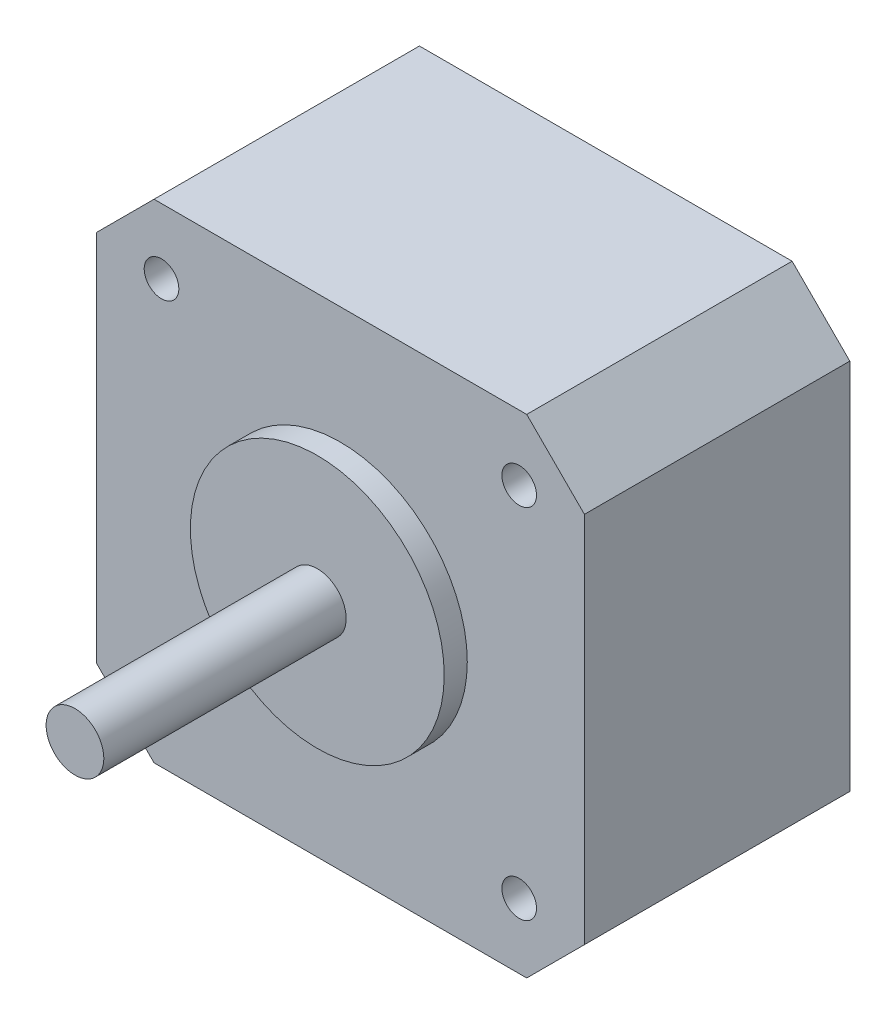
from build123d import *

# Parameters (mm, degrees)
SKETCH1_W           = 42.3
SKETCH1_H           = 42.3
BOSS_EXTRUDE1_DEPTH = 23
CHAMFER1_SIZE       = 5
SKETCH3_R           = 1.5
CUT_EXTRUDE1_DEPTH  = 5
SKETCH4_R           = 11
BOSS_EXTRUDE2_DEPTH = 2
SKETCH5_R           = 2.5
BOSS_EXTRUDE3_DEPTH = 23
SKETCH6_W           = 16
SKETCH6_H           = 7
BOSS_EXTRUDE4_DEPTH = 9.6


with BuildPart() as part:
    # Sketch1 → Boss-Extrude1 (new body)
    with BuildSketch(Plane.XY):
        Rectangle(SKETCH1_W, SKETCH1_H)
    extrude(amount=-BOSS_EXTRUDE1_DEPTH)

    # Chamfer1
    chamfer1_edges = [part.edges().sort_by_distance(p)[0] for p in [
        (21.15, -21.15, -11.5),
        (-21.15, -21.15, -11.5),
        (-21.15, 21.15, -11.5),
        (21.15, 21.15, -11.5),
    ]]
    chamfer(chamfer1_edges, length=CHAMFER1_SIZE)

    # Sketch3 → Cut-Extrude1 (cut)
    with BuildSketch(Plane.XY):
        with Locations((15.5, -15.5)):
            Circle(SKETCH3_R)
        with Locations((-15.5, -15.5)):
            Circle(SKETCH3_R)
        with Locations((-15.5, 15.5)):
            Circle(SKETCH3_R)
        with Locations((15.5, 15.5)):
            Circle(SKETCH3_R)
    extrude(amount=-CUT_EXTRUDE1_DEPTH, mode=Mode.SUBTRACT)

    # Sketch4 → Boss-Extrude2 (add)
    with BuildSketch(Plane.XY):
        Circle(SKETCH4_R)
    extrude(amount=BOSS_EXTRUDE2_DEPTH)

    # Sketch5 → Boss-Extrude3 (add)
    with BuildSketch(Plane.XY):
        Circle(SKETCH5_R)
    extrude(amount=BOSS_EXTRUDE3_DEPTH)

    # Sketch6 → Boss-Extrude4 (add)
    with BuildSketch(Plane(origin=(0, 0, -23), x_dir=(-1, 0, 0), z_dir=(0, 0, -1))):
        with Locations((0, -24.65)):
            Rectangle(SKETCH6_W, SKETCH6_H)
    extrude(amount=-BOSS_EXTRUDE4_DEPTH)


solid = part.part
